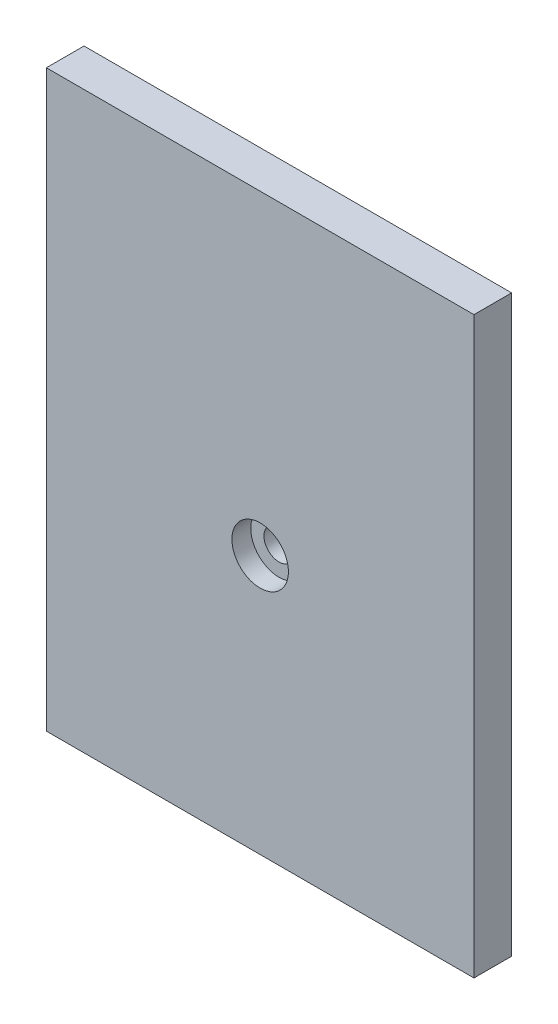
from build123d import *

# Parameters (mm, degrees)
SKETCH_1_W          = 45.4
SKETCH_1_H          = 61
EXTRUDE_1_DEPTH     = 4
SKETCH_2_W          = 12.5
SKETCH_2_H          = 18
CUT_EXTRUDE_1_DEPTH = 3.2
SKETCH_4_R          = 1.6
CUT_EXTRUDE_2_DEPTH = 10
SKETCH_5_R          = 3
CUT_EXTRUDE_3_DEPTH = 2
SKETCH_3_R          = 3.05
EXTRUDE_2_DEPTH     = 1.5


with BuildPart() as part:
    # 草图1 → 凸台-拉伸1 (new body)
    with BuildSketch(Plane.XY):
        with Locations((-49.741035857, 13.111663348)):
            Rectangle(SKETCH_1_W, SKETCH_1_H)
    extrude(amount=EXTRUDE_1_DEPTH)

    # 草图2 → 切除-拉伸1 (cut)
    with BuildSketch(Plane(origin=(0, 0, 0), x_dir=(-1, 0, 0), z_dir=(0, 0, -1))):
        with Locations((49.741035857, -8.388336652)):
            Rectangle(SKETCH_2_W, SKETCH_2_H)
    extrude(amount=-CUT_EXTRUDE_1_DEPTH, mode=Mode.SUBTRACT)

    # 草图4 → 切除-拉伸2 (cut)
    with BuildSketch(Plane.XY.offset(4)):
        with Locations((-49.741035857, 10.111663348)):
            Circle(SKETCH_4_R)
    extrude(amount=-CUT_EXTRUDE_2_DEPTH, mode=Mode.SUBTRACT)

    # 草图5 → 切除-拉伸3 (cut)
    with BuildSketch(Plane.XY.offset(4)):
        with Locations((-49.741035857, 10.111663348)):
            Circle(SKETCH_5_R)
    extrude(amount=-CUT_EXTRUDE_3_DEPTH, mode=Mode.SUBTRACT)

    # 草图3 → 凸台-拉伸2 (add)
    with BuildSketch(Plane(origin=(0, 0, 0), x_dir=(-1, 0, 0), z_dir=(0, 0, -1))):
        with Locations(Location((39.741035857, 0.111663348, 0), (0, 0, 180))):
            Circle(SKETCH_3_R)
        with Locations(Location((39.741035857, 20.111663348, 0), (0, 0, 180))):
            Circle(SKETCH_3_R)
        with Locations((59.741035857, 0.111663348)):
            Circle(SKETCH_3_R)
        with Locations((59.741035857, 20.111663348)):
            Circle(SKETCH_3_R)
    extrude(amount=EXTRUDE_2_DEPTH)


solid = part.part
